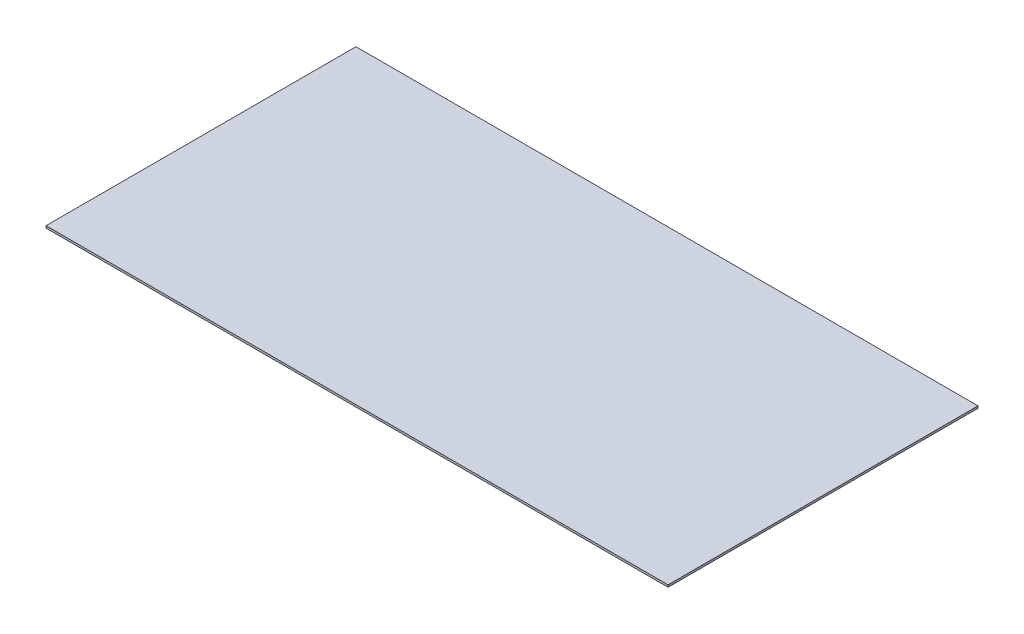
from build123d import *

# Parameters (mm, degrees)
SKETCH1_W           = 875
SKETCH1_H           = 436
BOSS_EXTRUDE1_DEPTH = 3


with BuildPart() as part:
    # Sketch1 → Boss-Extrude1 (new body)
    with BuildSketch(Plane(origin=(0, 0, 0), x_dir=(1, 0, 0), z_dir=(0, 1, 0))):
        Rectangle(SKETCH1_W, SKETCH1_H)
    extrude(amount=BOSS_EXTRUDE1_DEPTH)


solid = part.part
